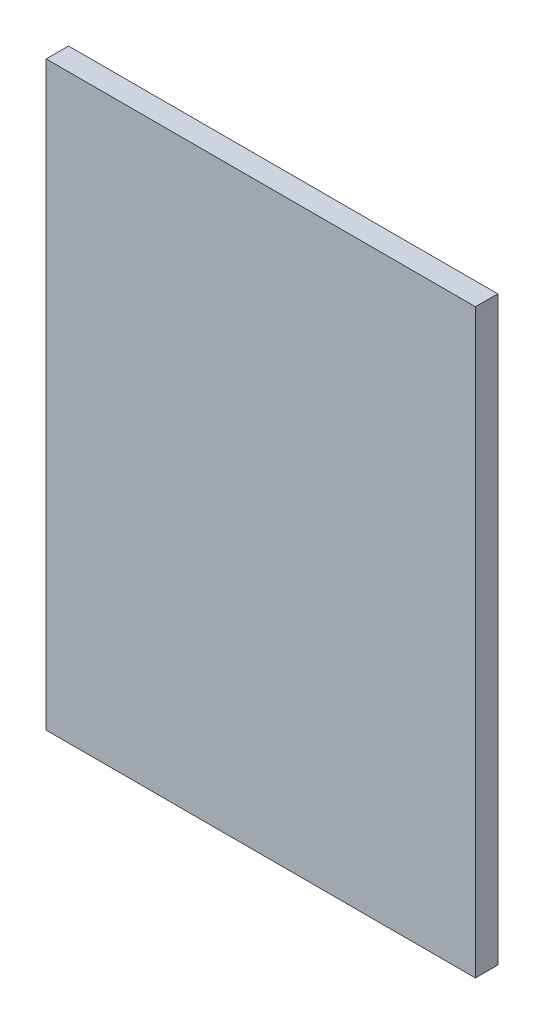
from build123d import *

# Parameters (mm, degrees)
SKETCH1_W           = 96
SKETCH1_H           = 130
BOSS_EXTRUDE1_DEPTH = 5


with BuildPart() as part:
    # Sketch1 → Boss-Extrude1 (new body)
    with BuildSketch(Plane.XY):
        with Locations((18.513409962, -13.314176245)):
            Rectangle(SKETCH1_W, SKETCH1_H)
    extrude(amount=BOSS_EXTRUDE1_DEPTH)


solid = part.part
